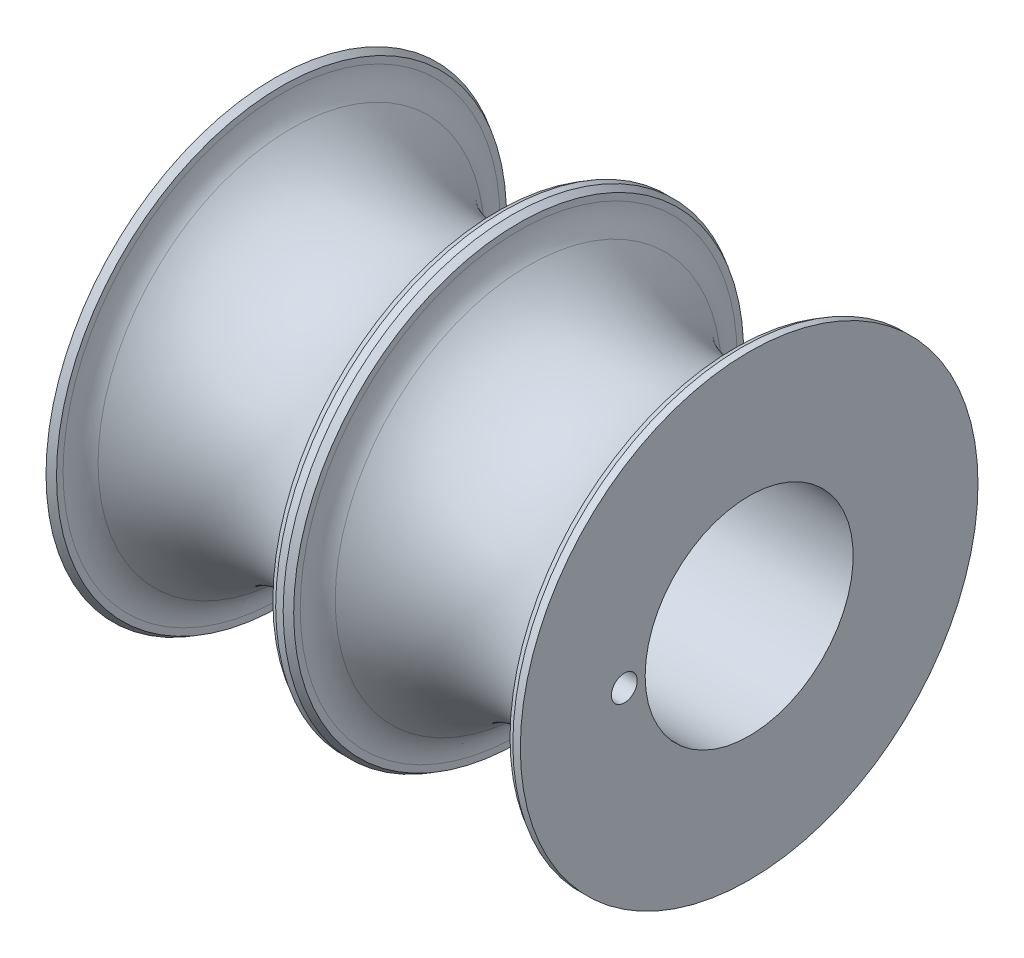
from build123d import *

# Parameters (mm, degrees)
F_3_0_3_DURCHMESSER_BOHRUNG2_D       = 3
F_3_0_3_DURCHMESSER_BOHRUNG2_DEPTH   = 5
F_3_0_3_DURCHMESSER_BOHRUNG2_TIP     = 0.901290929
F_3_1_3_1_DURCHMESSER_BOHRUNG2_D     = 3.1
F_3_1_3_1_DURCHMESSER_BOHRUNG2_DEPTH = 5
F_3_1_3_1_DURCHMESSER_BOHRUNG2_TIP   = 0.931333959


with BuildPart() as part:
    # Skizze1 → Rotation2 (revolve)
    with BuildSketch(Plane.XY, mode=Mode.PRIVATE) as rotation2_sk:
        with BuildLine():
            Line((0, 12.5), (57, 12.5))
            Line((57, 12.5), (57, 27.5))
            Line((57, 27.5), (56.1, 27.5))
            Line((56.1, 27.5), (55.3, 27.038119785))
            Line((55.3, 27.038119785), (55.3, 26.25))
            ThreePointArc((55.3, 26.25), (54.996271637, 24.624790983), (54.126086957, 23.218969555))
            ThreePointArc((54.126086957, 23.218969555), (48.599332181, 19.288199558), (41.940765292, 18))
            ThreePointArc((41.940765292, 18), (35.672034489, 19.43334079), (30.473913043, 23.218969555))
            ThreePointArc((30.473913043, 23.218969555), (29.603728363, 24.624790983), (29.3, 26.25))
            Line((29.3, 26.25), (29.3, 27.038119785))
            Line((29.3, 27.038119785), (28.5, 27.5))
            Line((28.5, 27.5), (27.6, 27.5))
            Line((27.6, 27.5), (26.8, 27.038119785))
            Line((26.8, 27.038119785), (26.8, 26.25))
            ThreePointArc((26.8, 26.25), (26.496271637, 24.624790983), (25.626086957, 23.218969555))
            ThreePointArc((25.626086957, 23.218969555), (20.099332181, 19.288199558), (13.440765292, 18))
            ThreePointArc((13.440765292, 18), (7.172034489, 19.43334079), (1.973913043, 23.218969555))
            ThreePointArc((1.973913043, 23.218969555), (1.103728363, 24.624790983), (0.8, 26.25))
            Line((0.8, 26.25), (0.8, 27.038119785))
            Line((0.8, 27.038119785), (0, 27.5))
            Line((0, 27.5), (0, 12.5))
        make_face()
    revolve(rotation2_sk.sketch.rotate(Axis((-27.830787446, 0, 0), (1, 0, 0)), 90), axis=Axis((-27.830787446, 0, 0), (1, 0, 0)))

    # Ø3.0 (3) Durchmesser Bohrung2
    with Locations(Plane.ZY):
        with Locations((-15, 0)):
            Hole(F_3_0_3_DURCHMESSER_BOHRUNG2_D / 2, depth=F_3_0_3_DURCHMESSER_BOHRUNG2_DEPTH)
            with Locations((0, 0, -(F_3_0_3_DURCHMESSER_BOHRUNG2_DEPTH + F_3_0_3_DURCHMESSER_BOHRUNG2_TIP / 2))):  # 118° drill point
                Cone(0, F_3_0_3_DURCHMESSER_BOHRUNG2_D / 2, F_3_0_3_DURCHMESSER_BOHRUNG2_TIP, mode=Mode.SUBTRACT)

    # Ø3.1 (3.1) Durchmesser Bohrung2
    with Locations(Plane(origin=(57, 0, 0), x_dir=(0, 0, -1), z_dir=(1, 0, 0))):
        with Locations((-15, 0)):
            Hole(F_3_1_3_1_DURCHMESSER_BOHRUNG2_D / 2, depth=F_3_1_3_1_DURCHMESSER_BOHRUNG2_DEPTH)
            with Locations((0, 0, -(F_3_1_3_1_DURCHMESSER_BOHRUNG2_DEPTH + F_3_1_3_1_DURCHMESSER_BOHRUNG2_TIP / 2))):  # 118° drill point
                Cone(0, F_3_1_3_1_DURCHMESSER_BOHRUNG2_D / 2, F_3_1_3_1_DURCHMESSER_BOHRUNG2_TIP, mode=Mode.SUBTRACT)


solid = part.part
